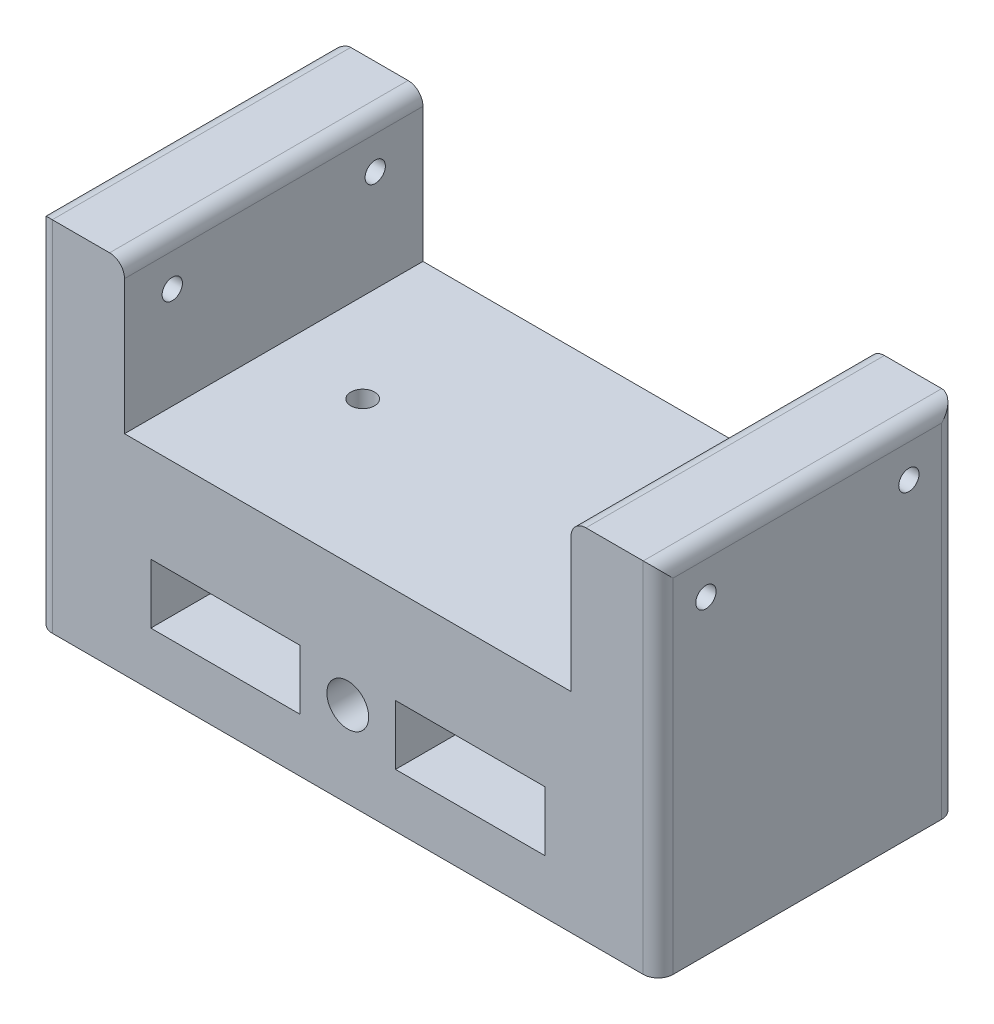
from build123d import *

# Parameters (mm, degrees)
SKETCH1_W                      = 104
SKETCH1_H                      = 50
BOSS_EXTRUDE1_DEPTH            = 10
SKETCH2_W                      = 104
SKETCH2_H                      = 50
BOSS_EXTRUDE2_DEPTH            = 25
SKETCH3_W                      = 14.6
SKETCH3_H                      = 50
BOSS_EXTRUDE3_DEPTH            = 25
CUT_EXTRUDE1_DEPTH             = 113.543324991
CUT_EXTRUDE1_DEPTH_BACK        = 113.543324991
SKETCH4_R                      = 1.7
CUT_EXTRUDE2_DEPTH             = 68.483331275
CUT_EXTRUDE2_DEPTH_BACK        = 68.483331275
SKETCH5_R                      = 2
CUT_EXTRUDE4_REACH             = 82.181
SKETCH8_R                      = 3.5
CUT_EXTRUDE4_DIRECTION_2_DEPTH = 81.181045142
FILLET1_R                      = 2.5
CUT_EXTRUDE6_REACH             = 82.181
CUT_EXTRUDE6_DIRECTION_2_DEPTH = 81.181045142
CUT_EXTRUDE7_REACH             = 82.181
SKETCH10_W                     = 25
SKETCH10_H                     = 10
CUT_EXTRUDE7_DIRECTION_2_DEPTH = 81.181045142


with BuildPart() as part:
    # Sketch1 → Boss-Extrude1 (new body)
    with BuildSketch(Plane(origin=(0, 0, 0), x_dir=(1, 0, 0), z_dir=(0, 1, 0))):
        Rectangle(SKETCH1_W, SKETCH1_H)
    extrude(amount=BOSS_EXTRUDE1_DEPTH)

    # Sketch2 → Boss-Extrude2 (add)
    with BuildSketch(Plane.XZ):
        Rectangle(SKETCH2_W, SKETCH2_H)
        Polygon((-45.5, 13.5), (-45.5, 0), (-45.5, -13.5), (0, -13.5), (45.5, -13.5), (45.5, 0), (45.5, 13.5), (0, 13.5), align=None, mode=Mode.SUBTRACT)
    extrude(amount=BOSS_EXTRUDE2_DEPTH)

    # Sketch3 → Boss-Extrude3 (add)
    with BuildSketch(Plane(origin=(0, 10, 0), x_dir=(1, 0, 0), z_dir=(0, 1, 0))):
        with Locations((-44.7, 0)):
            Rectangle(SKETCH3_W, SKETCH3_H)
        with Locations((44.7, 0)):
            Rectangle(SKETCH3_W, SKETCH3_H)
    extrude(amount=BOSS_EXTRUDE3_DEPTH)

    # Sketch4 → Cut-Extrude1 (cut, two sides: drawn at the far end of the back side and taken through both)
    with BuildSketch(Plane(origin=(52, 0, 0), x_dir=(0, 0, -1), z_dir=(1, 0, 0)).offset(-CUT_EXTRUDE1_DEPTH_BACK)):
        with Locations((17, 27)):
            Circle(SKETCH4_R)
        with Locations((-17, 27)):
            Circle(SKETCH4_R)
    extrude(amount=CUT_EXTRUDE1_DEPTH + CUT_EXTRUDE1_DEPTH_BACK, mode=Mode.SUBTRACT)

    # Sketch5 → Cut-Extrude2 (cut, two sides: drawn at the far end of the back side and taken through both)
    with BuildSketch(Plane(origin=(0, 10, 0), x_dir=(1, 0, 0), z_dir=(0, 1, 0)).offset(-CUT_EXTRUDE2_DEPTH_BACK)):
        with Locations(Location((-22.5, 0, 0), (0, 0, 270))):
            Circle(SKETCH5_R)
        with Locations(Location((22.5, 0, 0), (0, 0, 270))):
            Circle(SKETCH5_R)
    extrude(amount=CUT_EXTRUDE2_DEPTH + CUT_EXTRUDE2_DEPTH_BACK, mode=Mode.SUBTRACT)

    # Sketch8 → Cut-Extrude4 (cut, up to next)
    with BuildSketch(Plane.XY.offset(25), mode=Mode.PRIVATE) as cut_extrude4_sk1:
        with Locations(Location((0, -10.65, 0), (0, 0, 180))):
            Circle(SKETCH8_R)
    cut_extrude4_tool1 = extrude(cut_extrude4_sk1.sketch, amount=-CUT_EXTRUDE4_REACH, mode=Mode.PRIVATE) & part.part
    add(cut_extrude4_tool1.solids().sort_by_distance((0, -10.65, 25))[0], mode=Mode.SUBTRACT)

    # Sketch8 → Cut-Extrude4 direction 2 (cut)
    with BuildSketch(Plane.XY.offset(25)):
        with Locations(Location((0, -10.65, 0), (0, 0, 180))):
            Circle(SKETCH8_R)
    extrude(amount=CUT_EXTRUDE4_DIRECTION_2_DEPTH, mode=Mode.SUBTRACT)

    # Fillet1
    fillet1_edges = [part.edges().sort_by_distance(p)[0] for p in [
        (-52, 35, 0),
        (-37.4, 35, 0),
        (37.4, 35, 0),
        (52, 35, 0),
        (-52, 5, 25),
        (-52, 5, -25),
        (52, 5, -25),
        (52, 5, 25),
    ]]
    fillet(fillet1_edges, radius=FILLET1_R)

    # Sketch9 → Cut-Extrude6 (cut, up to next)
    with BuildSketch(Plane(origin=(0, 0, -25), x_dir=(-1, 0, 0), z_dir=(0, 0, -1)), mode=Mode.PRIVATE) as cut_extrude6_sk1:
        Polygon((-33, -6), (-33, -16), (0, -16), (33, -16), (33, -6), (0, -6), align=None)
    cut_extrude6_tool1 = extrude(cut_extrude6_sk1.sketch, amount=-CUT_EXTRUDE6_REACH, mode=Mode.PRIVATE) & part.part
    add(cut_extrude6_tool1.solids().sort_by_distance((0, -11, -25))[0], mode=Mode.SUBTRACT)

    # Sketch9 → Cut-Extrude6 direction 2 (cut)
    with BuildSketch(Plane(origin=(0, 0, -25), x_dir=(-1, 0, 0), z_dir=(0, 0, -1))):
        Polygon((-33, -6), (-33, -16), (0, -16), (33, -16), (33, -6), (0, -6), align=None)
    extrude(amount=CUT_EXTRUDE6_DIRECTION_2_DEPTH, mode=Mode.SUBTRACT)

    # Sketch10 → Cut-Extrude7 (cut, up to next)
    with BuildSketch(Plane.XY.offset(25), mode=Mode.PRIVATE) as cut_extrude7_sk1:
        with Locations((-20.5, -11)):
            Rectangle(SKETCH10_W, SKETCH10_H)
    cut_extrude7_tool1 = extrude(cut_extrude7_sk1.sketch, amount=-CUT_EXTRUDE7_REACH, mode=Mode.PRIVATE) & part.part
    # Sketch10 → Cut-Extrude7 (cut, up to next)
    with BuildSketch(Plane.XY.offset(25), mode=Mode.PRIVATE) as cut_extrude7_sk2:
        with Locations((20.5, -11)):
            Rectangle(SKETCH10_W, SKETCH10_H)
    cut_extrude7_tool2 = extrude(cut_extrude7_sk2.sketch, amount=-CUT_EXTRUDE7_REACH, mode=Mode.PRIVATE) & part.part
    add(cut_extrude7_tool1.solids().sort_by_distance((-20.5, -11, 25))[0], mode=Mode.SUBTRACT)
    add(cut_extrude7_tool2.solids().sort_by_distance((20.5, -11, 25))[0], mode=Mode.SUBTRACT)

    # Sketch10 → Cut-Extrude7 direction 2 (cut)
    with BuildSketch(Plane.XY.offset(25)):
        with Locations((-20.5, -11)):
            Rectangle(SKETCH10_W, SKETCH10_H)
        with Locations((20.5, -11)):
            Rectangle(SKETCH10_W, SKETCH10_H)
    extrude(amount=CUT_EXTRUDE7_DIRECTION_2_DEPTH, mode=Mode.SUBTRACT)


solid = part.part
